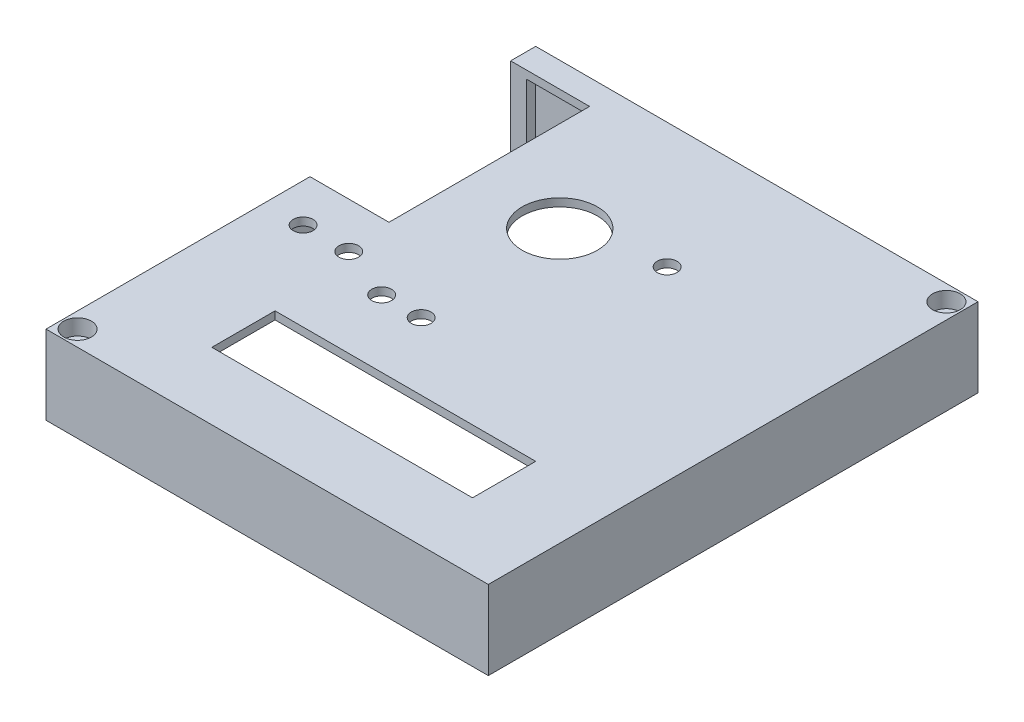
from build123d import *

# Parameters (mm, degrees)
SKETCH1_W           = 112
SKETCH1_H           = 124
BOSS_EXTRUDE1_DEPTH = 2
SKETCH4_W           = 112
SKETCH4_H           = 124
BOSS_EXTRUDE2_DEPTH = 18
CUT_EXTRUDE1_REACH  = 87.907
SKETCH5_R           = 9.525
SKETCH5_R_2         = 2.5
SKETCH5_W           = 66
SKETCH5_H           = 16
SKETCH6_R           = 2
CUT_EXTRUDE2_DEPTH  = 86.90692638
SKETCH7_R           = 3.5
CUT_EXTRUDE3_DEPTH  = 4
SKETCH8_W           = 50.8
SKETCH8_H           = 20
CUT_EXTRUDE4_DEPTH  = 20


with BuildPart() as part:
    # Sketch1 → Boss-Extrude1 (new body)
    with BuildSketch(Plane(origin=(0, 0, 0), x_dir=(1, 0, 0), z_dir=(0, 1, 0))):
        Rectangle(SKETCH1_W, SKETCH1_H)
    extrude(amount=BOSS_EXTRUDE1_DEPTH)

    # Sketch4 → Boss-Extrude2 (add)
    with BuildSketch(Plane.XZ):
        Rectangle(SKETCH4_W, SKETCH4_H)
        Polygon((-48, 58), (-48, 54), (-52, 54), (-52, -58), (48, -58), (48, -54), (52, -54), (52, 58), align=None, mode=Mode.SUBTRACT)
    extrude(amount=BOSS_EXTRUDE2_DEPTH)

    # Sketch5 → Cut-Extrude1 (cut, up to next)
    with BuildSketch(Plane(origin=(0, 2, 0), x_dir=(1, 0, 0), z_dir=(0, 1, 0)), mode=Mode.PRIVATE) as cut_extrude1_sk1:
        with Locations(Location((-13, 25.1, 0), (0, 0, 270))):
            Circle(SKETCH5_R)
    cut_extrude1_tool1 = extrude(cut_extrude1_sk1.sketch, amount=-CUT_EXTRUDE1_REACH, mode=Mode.PRIVATE) & part.part
    # Sketch5 → Cut-Extrude1 (cut, up to next)
    with BuildSketch(Plane(origin=(0, 2, 0), x_dir=(1, 0, 0), z_dir=(0, 1, 0)), mode=Mode.PRIVATE) as cut_extrude1_sk2:
        with Locations(Location((-46.27, -6.63, 0), (0, 0, 270))):
            Circle(SKETCH5_R_2)
    cut_extrude1_tool2 = extrude(cut_extrude1_sk2.sketch, amount=-CUT_EXTRUDE1_REACH, mode=Mode.PRIVATE) & part.part
    # Sketch5 → Cut-Extrude1 (cut, up to next)
    with BuildSketch(Plane(origin=(0, 2, 0), x_dir=(1, 0, 0), z_dir=(0, 1, 0)), mode=Mode.PRIVATE) as cut_extrude1_sk3:
        with Locations(Location((-34.7, -6.63, 0), (0, 0, 270))):
            Circle(SKETCH5_R_2)
    cut_extrude1_tool3 = extrude(cut_extrude1_sk3.sketch, amount=-CUT_EXTRUDE1_REACH, mode=Mode.PRIVATE) & part.part
    # Sketch5 → Cut-Extrude1 (cut, up to next)
    with BuildSketch(Plane(origin=(0, 2, 0), x_dir=(1, 0, 0), z_dir=(0, 1, 0)), mode=Mode.PRIVATE) as cut_extrude1_sk4:
        with Locations(Location((-21, -12, 0), (0, 0, 270))):
            Circle(SKETCH5_R_2)
    cut_extrude1_tool4 = extrude(cut_extrude1_sk4.sketch, amount=-CUT_EXTRUDE1_REACH, mode=Mode.PRIVATE) & part.part
    # Sketch5 → Cut-Extrude1 (cut, up to next)
    with BuildSketch(Plane(origin=(0, 2, 0), x_dir=(1, 0, 0), z_dir=(0, 1, 0)), mode=Mode.PRIVATE) as cut_extrude1_sk5:
        with Locations(Location((-11, -12, 0), (0, 0, 270))):
            Circle(SKETCH5_R_2)
    cut_extrude1_tool5 = extrude(cut_extrude1_sk5.sketch, amount=-CUT_EXTRUDE1_REACH, mode=Mode.PRIVATE) & part.part
    # Sketch5 → Cut-Extrude1 (cut, up to next)
    with BuildSketch(Plane(origin=(0, 2, 0), x_dir=(1, 0, 0), z_dir=(0, 1, 0)), mode=Mode.PRIVATE) as cut_extrude1_sk6:
        with Locations(Location((9, 30.28, 0), (0, 0, 270))):
            Circle(SKETCH5_R_2)
    cut_extrude1_tool6 = extrude(cut_extrude1_sk6.sketch, amount=-CUT_EXTRUDE1_REACH, mode=Mode.PRIVATE) & part.part
    # Sketch5 → Cut-Extrude1 (cut, up to next)
    with BuildSketch(Plane(origin=(0, 2, 0), x_dir=(1, 0, 0), z_dir=(0, 1, 0)), mode=Mode.PRIVATE) as cut_extrude1_sk7:
        with Locations((2, -37)):
            Rectangle(SKETCH5_W, SKETCH5_H)
    cut_extrude1_tool7 = extrude(cut_extrude1_sk7.sketch, amount=-CUT_EXTRUDE1_REACH, mode=Mode.PRIVATE) & part.part
    add(cut_extrude1_tool1.solids().sort_by_distance((-13, 2, -25.1))[0], mode=Mode.SUBTRACT)
    add(cut_extrude1_tool2.solids().sort_by_distance((-46.27, 2, 6.63))[0], mode=Mode.SUBTRACT)
    add(cut_extrude1_tool3.solids().sort_by_distance((-34.7, 2, 6.63))[0], mode=Mode.SUBTRACT)
    add(cut_extrude1_tool4.solids().sort_by_distance((-21, 2, 12))[0], mode=Mode.SUBTRACT)
    add(cut_extrude1_tool5.solids().sort_by_distance((-11, 2, 12))[0], mode=Mode.SUBTRACT)
    add(cut_extrude1_tool6.solids().sort_by_distance((9, 2, -30.28))[0], mode=Mode.SUBTRACT)
    add(cut_extrude1_tool7.solids().sort_by_distance((2, 2, 37))[0], mode=Mode.SUBTRACT)

    # Sketch6 → Cut-Extrude2 (cut, through all)
    with BuildSketch(Plane(origin=(0, 2, 0), x_dir=(1, 0, 0), z_dir=(0, 1, 0))):
        with Locations(Location((52, 58, 0), (0, 0, 270))):
            Circle(SKETCH6_R)
        with Locations(Location((-52, -58, 0), (0, 0, 270))):
            Circle(SKETCH6_R)
    extrude(amount=-CUT_EXTRUDE2_DEPTH, mode=Mode.SUBTRACT)

    # Sketch7 → Cut-Extrude3 (cut)
    with BuildSketch(Plane(origin=(0, 2, 0), x_dir=(1, 0, 0), z_dir=(0, 1, 0))):
        with Locations(Location((-52, -58, 0), (0, 0, 270))):
            Circle(SKETCH7_R)
        with Locations(Location((52, 58, 0), (0, 0, 270))):
            Circle(SKETCH7_R)
    extrude(amount=-CUT_EXTRUDE3_DEPTH, mode=Mode.SUBTRACT)

    # Sketch8 → Cut-Extrude4 (cut)
    with BuildSketch(Plane.ZY.offset(56)):
        with Locations((-30.25, -8)):
            Rectangle(SKETCH8_W, SKETCH8_H)
    extrude(amount=-CUT_EXTRUDE4_DEPTH, mode=Mode.SUBTRACT)


solid = part.part
